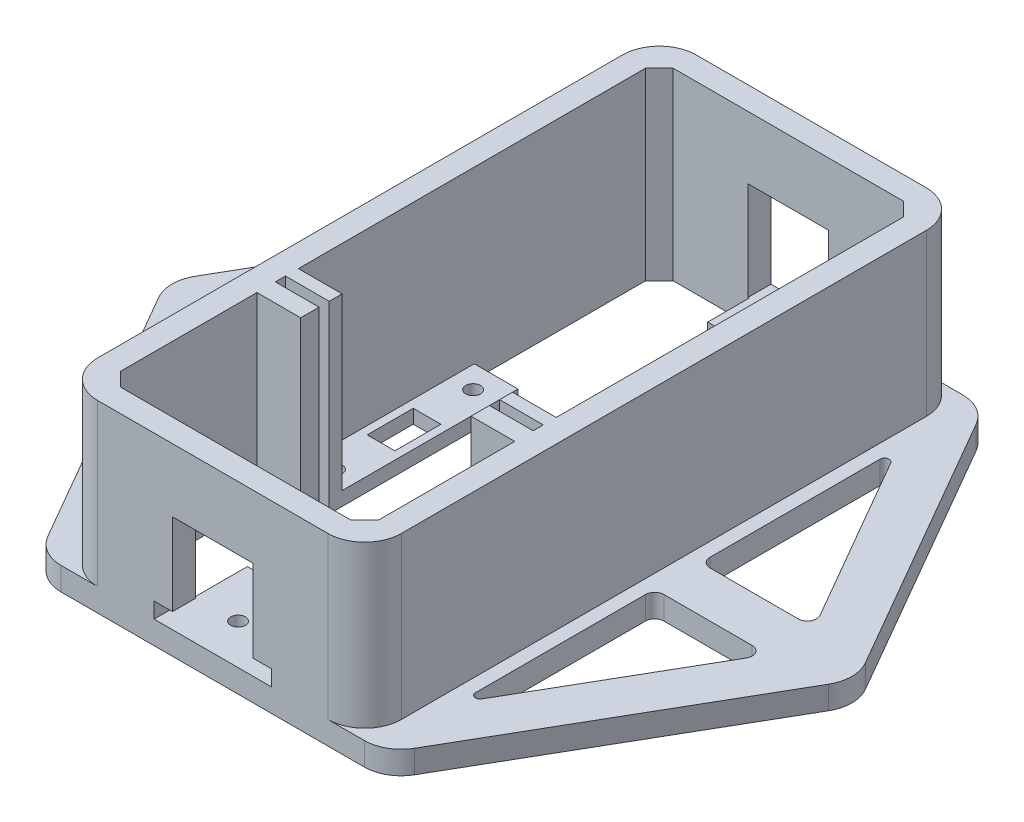
from build123d import *

# Parameters (mm, degrees)
BOSS_EXTRUDE1_DEPTH = 5
FILLET1_R           = 8
BOSS_EXTRUDE2_DEPTH = 35
CUT_EXTRUDE1_DEPTH  = 40
CUT_EXTRUDE2_DEPTH  = 5
SKETCH9_W           = 9.5
SKETCH9_H           = 40
BOSS_EXTRUDE3_DEPTH = 3
SKETCH10_R          = 1.6
SKETCH10_W          = 6
SKETCH10_H          = 10
CUT_EXTRUDE3_DEPTH  = 3
SKETCH11_W          = 9.5
SKETCH11_H          = 4
BOSS_EXTRUDE4_DEPTH = 40
SKETCH13_W          = 25
SKETCH13_H          = 5
BOSS_EXTRUDE5_DEPTH = 15
SKETCH15_R          = 1.6
CUT_EXTRUDE4_DEPTH  = 5
CUT_EXTRUDE5_DEPTH  = 5
SKETCH17_W          = 17
SKETCH17_H          = 5
BOSS_EXTRUDE6_DEPTH = 9
SKETCH18_R          = 1.6
CUT_EXTRUDE6_DEPTH  = 5
CUT_EXTRUDE8_DEPTH  = 5


with BuildPart() as part:
    # Sketch1 → Boss-Extrude1 (new body)
    with BuildSketch(Plane(origin=(0, 0, 0), x_dir=(1, 0, 0), z_dir=(0, 1, 0))):
        Polygon((-75.055534995, 0), (-37.527767497, -65), (37.527767497, -65), (75.055534995, 0), (37.527767497, 65), (-37.527767497, 65), align=None)
    extrude(amount=BOSS_EXTRUDE1_DEPTH)

    # Fillet1
    fillet1_edges = [part.edges().sort_by_distance(p)[0] for p in [
        (-37.527767497, 2.5, -65),
        (37.527767497, 2.5, -65),
        (75.055534995, 2.5, 0),
        (37.527767497, 2.5, 65),
        (-37.527767497, 2.5, 65),
        (-75.055534995, 2.5, 0),
    ]]
    fillet(fillet1_edges, radius=FILLET1_R)

    # Sketch3 → Boss-Extrude2 (add)
    with BuildSketch(Plane(origin=(0, 5, 0), x_dir=(1, 0, 0), z_dir=(0, 1, 0))):
        with BuildLine():
            Line((-25, 65), (25, 65))
            ThreePointArc((25, 65), (30.656854249, 62.656854249), (33, 57))
            Line((33, 57), (33, -57))
            ThreePointArc((33, -57), (30.656854249, -62.656854249), (25, -65))
            Line((25, -65), (-25, -65))
            ThreePointArc((-25, -65), (-30.656854249, -62.656854249), (-33, -57))
            Line((-33, -57), (-33, 57))
            ThreePointArc((-33, 57), (-30.656854249, 62.656854249), (-25, 65))
        make_face()
    extrude(amount=BOSS_EXTRUDE2_DEPTH)

    # Sketch4 → Cut-Extrude1 (cut)
    with BuildSketch(Plane(origin=(0, 40, 0), x_dir=(1, 0, 0), z_dir=(0, 1, 0))):
        Polygon((-28, 57), (-25, 60), (25, 60), (28, 57), (28, -57), (25, -60), (-25, -60), (-28, -57), align=None)
    extrude(amount=-CUT_EXTRUDE1_DEPTH, mode=Mode.SUBTRACT)

    # Sketch8 → Cut-Extrude2 (cut)
    with BuildSketch(Plane(origin=(0, 0, 0), x_dir=(1, 0, 0), z_dir=(0, 1, 0))):
        with BuildLine():
            Line((-37.866025404, 44.41412012), (-58.889727457, 8))
            ThreePointArc((-58.889727457, 8), (-58.889727457, 6), (-57.15767665, 5))
            Line((-57.15767665, 5), (-38, 5))
            ThreePointArc((-38, 5), (-36.585786438, 5.585786438), (-36, 7))
            Line((-36, 7), (-36, 43.91412012))
            ThreePointArc((-36, 43.91412012), (-36.741180955, 44.880045946), (-37.866025404, 44.41412012))
        make_face()
        with BuildLine():
            Line((-36, -7), (-36, -43.91412012))
            ThreePointArc((-36, -43.91412012), (-36.741180955, -44.880045946), (-37.866025404, -44.41412012))
            Line((-37.866025404, -44.41412012), (-58.889727457, -8))
            ThreePointArc((-58.889727457, -8), (-58.889727457, -6), (-57.15767665, -5))
            Line((-57.15767665, -5), (-38, -5))
            ThreePointArc((-38, -5), (-36.585786438, -5.585786438), (-36, -7))
        make_face()
        with BuildLine():
            Line((37.866025404, -44.41412012), (58.889727457, -8))
            ThreePointArc((58.889727457, -8), (58.889727457, -6), (57.15767665, -5))
            Line((57.15767665, -5), (38, -5))
            ThreePointArc((38, -5), (36.585786438, -5.585786438), (36, -7))
            Line((36, -7), (36, -43.91412012))
            ThreePointArc((36, -43.91412012), (36.741180955, -44.880045946), (37.866025404, -44.41412012))
        make_face()
        with BuildLine():
            Line((36, 7), (36, 43.91412012))
            ThreePointArc((36, 43.91412012), (36.741180955, 44.880045946), (37.866025404, 44.41412012))
            Line((37.866025404, 44.41412012), (58.889727457, 8))
            ThreePointArc((58.889727457, 8), (58.889727457, 6), (57.15767665, 5))
            Line((57.15767665, 5), (38, 5))
            ThreePointArc((38, 5), (36.585786438, 5.585786438), (36, 7))
        make_face()
    extrude(amount=CUT_EXTRUDE2_DEPTH, mode=Mode.SUBTRACT)

    # Sketch9 → Boss-Extrude3 (add)
    with BuildSketch(Plane.XZ):
        with Locations((23.25, 0.197193855)):
            Rectangle(SKETCH9_W, SKETCH9_H)
        with Locations((-23.25, 0.197193855)):
            Rectangle(SKETCH9_W, SKETCH9_H)
    extrude(amount=-BOSS_EXTRUDE3_DEPTH)

    # Sketch10 → Cut-Extrude3 (cut)
    with BuildSketch(Plane(origin=(0, 3, 0), x_dir=(1, 0, 0), z_dir=(0, 1, 0))):
        with Locations(Location((23.25, -15.197193855, 0), (0, 0, 270))):
            Circle(SKETCH10_R)
        with Locations(Location((23.25, 14.802806145, 0), (0, 0, 270))):
            Circle(SKETCH10_R)
        with Locations(Location((-23.25, 14.802806145, 0), (0, 0, 270))):
            Circle(SKETCH10_R)
        with Locations(Location((-23.25, -15.197193855, 0), (0, 0, 270))):
            Circle(SKETCH10_R)
        with Locations((23.25, -0.197193855)):
            Rectangle(SKETCH10_W, SKETCH10_H)
        with Locations((-23.25, -0.197193855)):
            Rectangle(SKETCH10_W, SKETCH10_H)
    extrude(amount=-CUT_EXTRUDE3_DEPTH, mode=Mode.SUBTRACT)

    # Sketch11 → Boss-Extrude4 (add)
    with BuildSketch(Plane.XZ):
        with Locations((-23.25, 25.399999855)):
            Rectangle(SKETCH11_W, SKETCH11_H)
        Polygon((-28, 20.197193855), (-28, 21.197193855), (-18.5, 21.197193855), (-18.5, 18.394387855), (-28, 18.394387855), align=None)
        with Locations((23.25, 25.399999855)):
            Rectangle(SKETCH11_W, SKETCH11_H)
        Polygon((18.5, 21.197193855), (28, 21.197193855), (28, 20.197193855), (28, 18.394387855), (18.5, 18.394387855), align=None)
    extrude(amount=-BOSS_EXTRUDE4_DEPTH)

    # Sketch13 → Boss-Extrude5 (add)
    with BuildSketch(Plane(origin=(0, 0, 60), x_dir=(-1, 0, 0), z_dir=(0, 0, -1))):
        with Locations((0, 2.5)):
            Rectangle(SKETCH13_W, SKETCH13_H)
    extrude(amount=BOSS_EXTRUDE5_DEPTH)

    # Sketch15 → Cut-Extrude4 (cut)
    with BuildSketch(Plane.XZ):
        with Locations(Location((3.25, 48.75, 0), (0, 0, 270))):
            Circle(SKETCH15_R)
        with Locations(Location((3.25, 56.25, 0), (0, 0, 270))):
            Circle(SKETCH15_R)
        with Locations(Location((-3.25, 48.75, 0), (0, 0, 270))):
            Circle(SKETCH15_R)
        with Locations(Location((-3.25, 56.25, 0), (0, 0, 270))):
            Circle(SKETCH15_R)
    extrude(amount=-CUT_EXTRUDE4_DEPTH, mode=Mode.SUBTRACT)

    # Sketch16 → Cut-Extrude5 (cut)
    with BuildSketch(Plane.XY.offset(65)):
        Polygon((-12.75, 5), (12.75, 5), (12.75, 8.4), (8.75, 8.4), (8.75, 26.25), (-8.75, 26.25), (-8.75, 8.4), (-12.75, 8.4), align=None)
    extrude(amount=-CUT_EXTRUDE5_DEPTH, mode=Mode.SUBTRACT)

    # Sketch17 → Boss-Extrude6 (add)
    with BuildSketch(Plane.XY.offset(-60)):
        with Locations((0, 2.5)):
            Rectangle(SKETCH17_W, SKETCH17_H)
    extrude(amount=BOSS_EXTRUDE6_DEPTH)

    # Sketch18 → Cut-Extrude6 (cut)
    with BuildSketch(Plane.XZ):
        with Locations(Location((-3.25, -54.75, 0), (0, 0, 270))):
            Circle(SKETCH18_R)
        with Locations(Location((3.25, -54.75, 0), (0, 0, 90))):
            Circle(SKETCH18_R)
    extrude(amount=-CUT_EXTRUDE6_DEPTH, mode=Mode.SUBTRACT)

    # Sketch19 → Cut-Extrude8 (cut)
    with BuildSketch(Plane(origin=(0, 0, -65), x_dir=(-1, 0, 0), z_dir=(0, 0, -1))):
        Polygon((0, 5), (-8.75, 5), (-8.75, 26.4), (8.75, 26.4), (8.75, 5), align=None)
    extrude(amount=-CUT_EXTRUDE8_DEPTH, mode=Mode.SUBTRACT)


solid = part.part
